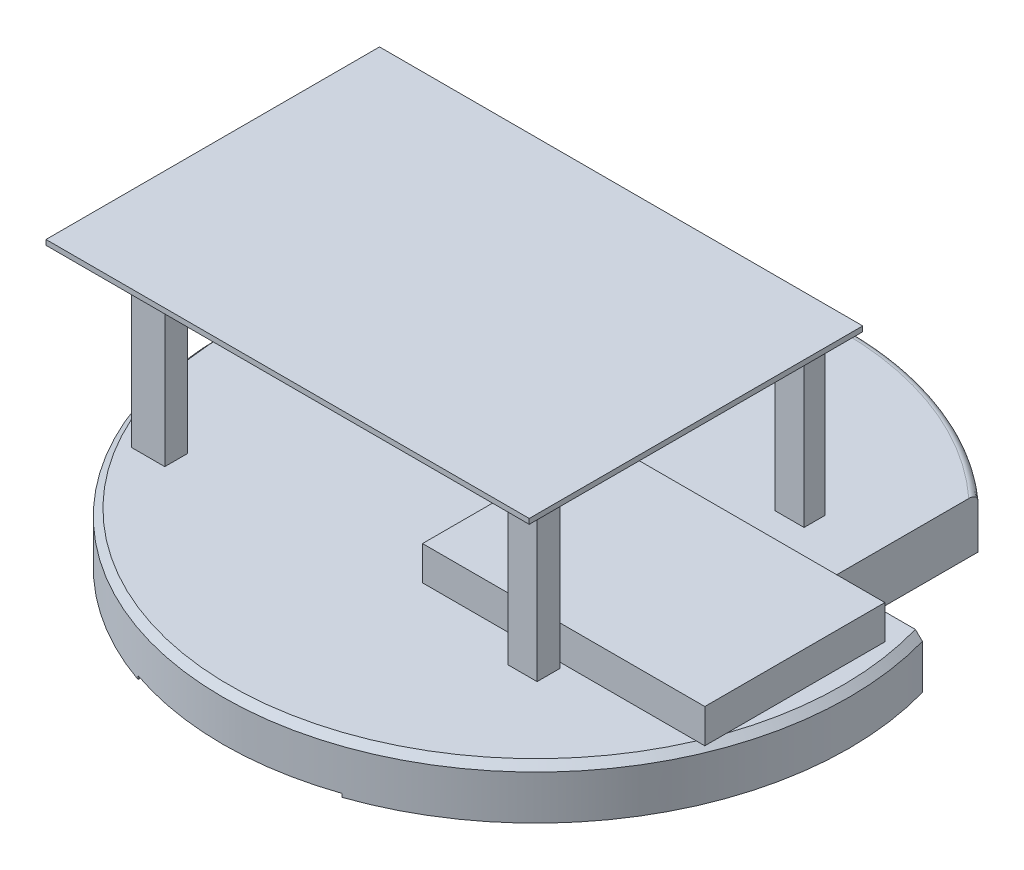
from build123d import *

# Parameters (mm, degrees)
EXTRUDE_1_DEPTH     = 15
SKETCH_2_W          = 60
SKETCH_2_H          = 43
CUT_EXTRUDE_1_DEPTH = 1
EXTRUDE_START       = 46
SKETCH_3_W          = 142
SKETCH_3_H          = 98
EXTRUDE_2_DEPTH     = 1.5
EXTRUDE_3_REACH     = 141.173
SKETCH_4_W          = 8.580803558
SKETCH_4_H          = 6.129145399
SKETCH_4_H_2        = 6.742059939
SKETCH_4_W_2        = 9.806632637
SKETCH_4_H_3        = 5.698922344
CHAMFER_1_SIZE      = 2
FILLET_1_R          = 2
SKETCH_5_W          = 58.826750964
SKETCH_5_H          = 40.858747532
EXTRUDE_4_DEPTH     = 19
SKETCH_6_W          = 82.94818023
SKETCH_6_H          = 52.919462164
EXTRUDE_5_DEPTH     = 10


with BuildPart() as part:
    # 草图1 → 凸台-拉伸1 (new body)
    with BuildSketch(Plane(origin=(0, 0, 0), x_dir=(1, 0, 0), z_dir=(0, 1, 0))):
        with BuildLine():
            Line((61, 68.869441699), (61, 25))
            Line((61, 25), (88.53812738, 25))
            ThreePointArc((88.53812738, 25), (0, -92), (-88.53812738, 25))
            Line((-88.53812738, 25), (-61, 25))
            Line((-61, 25), (-61, 68.869441699))
            ThreePointArc((-61, 68.869441699), (0, 92), (61, 68.869441699))
        make_face()
    extrude(amount=EXTRUDE_1_DEPTH)

    # 草图2 → 切除-拉伸1 (cut)
    with BuildSketch(Plane.XZ):
        with Locations((0, 71.283217175)):
            Rectangle(SKETCH_2_W, SKETCH_2_H)
    extrude(amount=-CUT_EXTRUDE_1_DEPTH, mode=Mode.SUBTRACT)


with BuildPart() as body_2:
    # 草图3 → 凸台-拉伸2 (new body)
    with BuildSketch(Plane(origin=(0, 15, 0), x_dir=(1, 0, 0), z_dir=(0, 1, 0)).offset(EXTRUDE_START)):
        with Locations((-22, -2)):
            Rectangle(SKETCH_3_W, SKETCH_3_H)
    extrude(amount=EXTRUDE_2_DEPTH)

    # 草图4 → 凸台-拉伸3 (add, up to next)
    with BuildSketch(Plane(origin=(0, 15, 0), x_dir=(1, 0, 0), z_dir=(0, 1, 0)), mode=Mode.PRIVATE) as extrude_3_sk1:
        with Locations((39.89053511, 37.643718522)):
            Rectangle(SKETCH_4_W, SKETCH_4_H)
    extrude_3_tool1 = extrude(extrude_3_sk1.sketch, amount=EXTRUDE_3_REACH, mode=Mode.PRIVATE) - body_2.part
    # 草图4 → 凸台-拉伸3 (add, up to next)
    with BuildSketch(Plane(origin=(0, 15, 0), x_dir=(1, 0, 0), z_dir=(0, 1, 0)), mode=Mode.PRIVATE) as extrude_3_sk2:
        with Locations((39.89053511, -40.502885308)):
            Rectangle(SKETCH_4_W, SKETCH_4_H_2)
    extrude_3_tool2 = extrude(extrude_3_sk2.sketch, amount=EXTRUDE_3_REACH, mode=Mode.PRIVATE) - body_2.part
    # 草图4 → 凸台-拉伸3 (add, up to next)
    with BuildSketch(Plane(origin=(0, 15, 0), x_dir=(1, 0, 0), z_dir=(0, 1, 0)), mode=Mode.PRIVATE) as extrude_3_sk3:
        with Locations((-70.127624791, -40.502885308)):
            Rectangle(SKETCH_4_W_2, SKETCH_4_H_2)
    extrude_3_tool3 = extrude(extrude_3_sk3.sketch, amount=EXTRUDE_3_REACH, mode=Mode.PRIVATE) - body_2.part
    # 草图4 → 凸台-拉伸3 (add, up to next)
    with BuildSketch(Plane(origin=(0, 15, 0), x_dir=(1, 0, 0), z_dir=(0, 1, 0)), mode=Mode.PRIVATE) as extrude_3_sk4:
        with Locations((-70.127624791, 18.84767654)):
            Rectangle(SKETCH_4_W_2, SKETCH_4_H_3)
    extrude_3_tool4 = extrude(extrude_3_sk4.sketch, amount=EXTRUDE_3_REACH, mode=Mode.PRIVATE) - body_2.part

    add(part.part)  # 凸台-拉伸3 merges part
    add(extrude_3_tool1.solids().sort_by_distance((39.890535, 15, -37.643719))[0])
    add(extrude_3_tool2.solids().sort_by_distance((39.890535, 15, 40.502885))[0])
    add(extrude_3_tool3.solids().sort_by_distance((-70.127625, 15, 40.502885))[0])
    add(extrude_3_tool4.solids().sort_by_distance((-70.127625, 15, -18.847677))[0])

    # 倒角1
    chamfer_1_edges = [body_2.edges().sort_by_distance(p)[0] for p in [
        (0, 15, 92),
    ]]
    chamfer(chamfer_1_edges, length=CHAMFER_1_SIZE)

    # 圆角1
    fillet_1_edges = [body_2.edges().sort_by_distance(p)[0] for p in [
        (0, 15, -92),
    ]]
    fillet(fillet_1_edges, radius=FILLET_1_R)

    # 草图5 → 凸台-拉伸4 (add)
    with BuildSketch(Plane.XZ):
        with Locations((-46.404556715, 7.01490545)):
            Rectangle(SKETCH_5_W, SKETCH_5_H)
    extrude(amount=EXTRUDE_4_DEPTH)

    # 草图6 → 凸台-拉伸5 (add)
    with BuildSketch(Plane(origin=(0, 15, 0), x_dir=(1, 0, 0), z_dir=(0, 1, 0))):
        with Locations((43.681597482, -9.107070233)):
            Rectangle(SKETCH_6_W, SKETCH_6_H)
    extrude(amount=EXTRUDE_5_DEPTH)


solid = body_2.part
